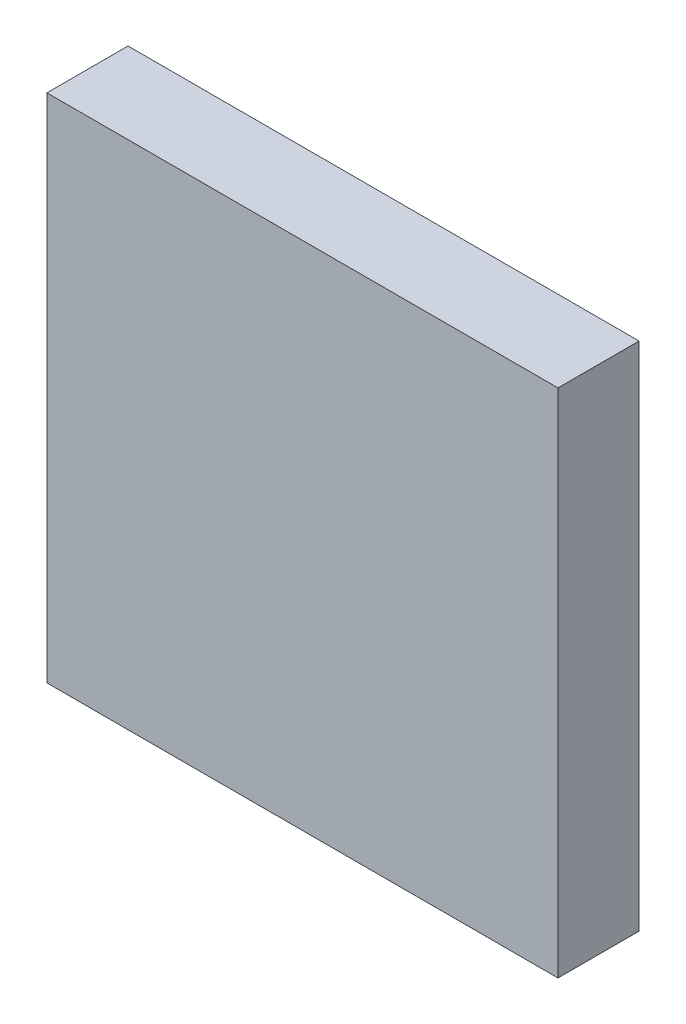
from build123d import *

# Parameters (mm, degrees)
SKETCH1_W           = 20
SKETCH1_H           = 20
BOSS_EXTRUDE1_DEPTH = 3.175


with BuildPart() as part:
    # Sketch1 → Boss-Extrude1 (new body)
    with BuildSketch(Plane.XY):
        with Locations((10, 10)):
            Rectangle(SKETCH1_W, SKETCH1_H)
    extrude(amount=BOSS_EXTRUDE1_DEPTH)


solid = part.part
